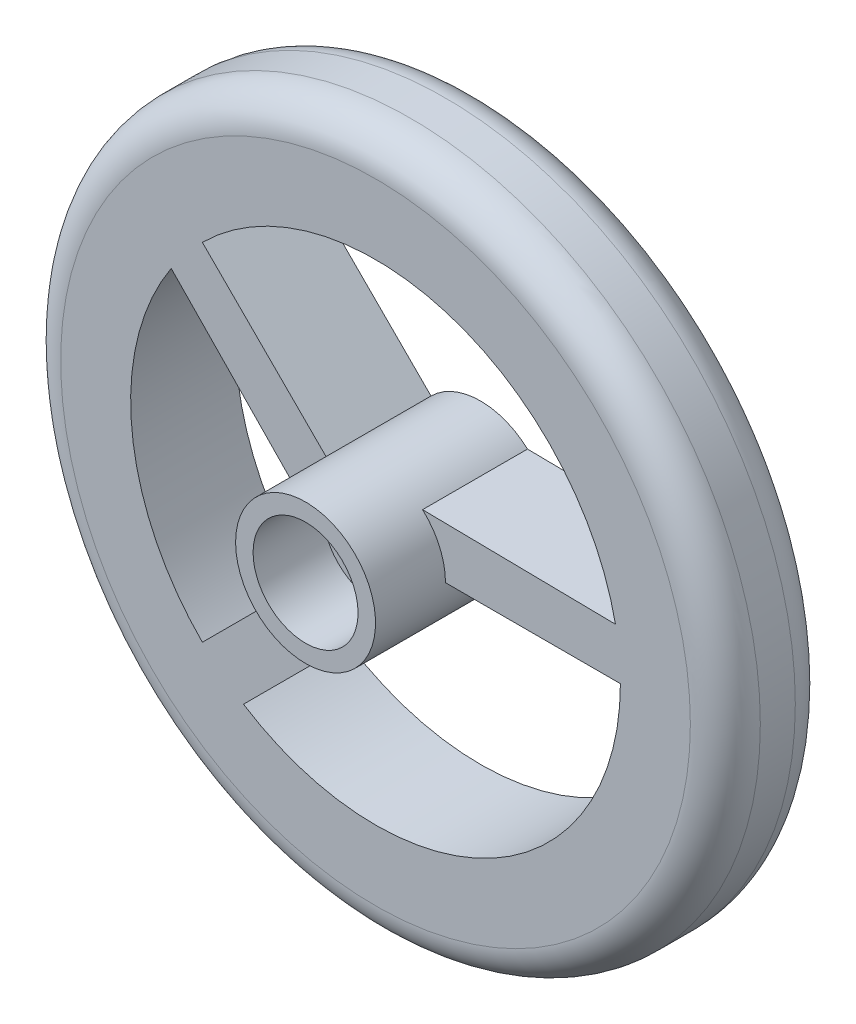
from build123d import *

# Parameters (mm, degrees)
SKETCH1_R           = 100
BOSS_EXTRUDE1_DEPTH = 30
FILLET2_R           = 10
SKETCH2_R           = 20
SKETCH2_R_2         = 15
BOSS_EXTRUDE2_DEPTH = 50


with BuildPart() as part:
    # Sketch1 → Boss-Extrude1 (new body)
    with BuildSketch(Plane.XY):
        Circle(SKETCH1_R)
        with BuildLine():
            Line((-10.606601718, -10.606601718), (-49.497474683, -49.497474683))
            ThreePointArc((-49.497474683, -49.497474683), (-69.64553071, -7.03562734), (-58.396917549, 38.597927675))
            Line((-58.396917549, 38.597927675), (-10.606601718, -10.606601718))
        make_face(mode=Mode.SUBTRACT)
        with BuildLine():
            ThreePointArc((10.606601718, -10.606601718), (13.858192988, -5.740251485), (15, 0))
            Line((15, 0), (70, 0))
            ThreePointArc((70, 0), (33.601511791, -61.407966954), (-37.741097297, -58.954300732))
            Line((-37.741097297, -58.954300732), (10.606601718, -10.606601718))
        make_face(mode=Mode.SUBTRACT)
        with BuildLine():
            ThreePointArc((0, 15), (-5.740251485, 13.858192988), (-10.606601718, 10.606601718))
            Line((-10.606601718, 10.606601718), (-49.497474683, 49.497474683))
            ThreePointArc((-49.497474683, 49.497474683), (20.152118643, 67.036498374), (68.585712798, 14))
            Line((68.585712798, 14), (0, 15))
        make_face(mode=Mode.SUBTRACT)
    extrude(amount=BOSS_EXTRUDE1_DEPTH)

    # Fillet2
    fillet2_edges = [part.edges().sort_by_distance(p)[0] for p in [
        (-100, 0, 0),
        (-100, 0, 30),
    ]]
    fillet(fillet2_edges, radius=FILLET2_R)

    # Sketch2 → Boss-Extrude2 (add)
    with BuildSketch(Plane(origin=(0, 0, 0), x_dir=(-1, 0, 0), z_dir=(0, 0, -1))):
        Circle(SKETCH2_R)
        Circle(SKETCH2_R_2, mode=Mode.SUBTRACT)
    extrude(amount=-BOSS_EXTRUDE2_DEPTH)


solid = part.part
